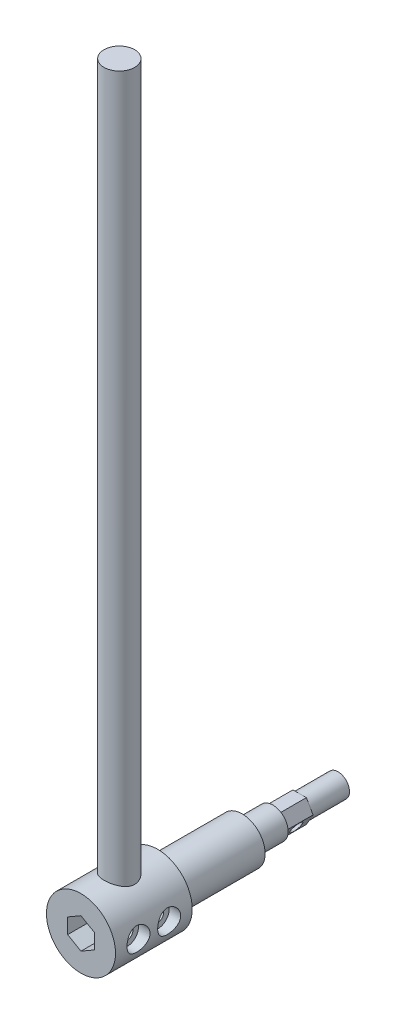
from build123d import *

# Parameters (mm, degrees)
SKETCH1_R                = 9
BOSS_EXTRUDE1_DEPTH      = 20
BOSS_EXTRUDE3_REACH      = 204.69
BOSS_EXTRUDE3_END_RADIUS = 9
SKETCH6_R                = 4
CUT_EXTRUDE1_DEPTH       = 9
CUT_EXTRUDE1_DEPTH_BACK  = 9
SKETCH8_R                = 1.55
SKETCH11_R               = 6
BOSS_EXTRUDE12_DEPTH     = 22
SKETCH12_R               = 4
BOSS_EXTRUDE13_DEPTH     = 8
BOSS_EXTRUDE14_DEPTH     = 7
SKETCH14_R               = 1.55
CUT_EXTRUDE2_DEPTH       = 6.1
SKETCH15_R               = 3
BOSS_EXTRUDE15_DEPTH     = 10
CUT_EXTRUDE5_START       = 9
SKETCH16_R               = 3
CUT_EXTRUDE5_DEPTH       = 3
CUT_EXTRUDE6_START       = -6
SKETCH16_2_R             = 3
CUT_EXTRUDE6_DEPTH       = 3


with BuildPart() as part:
    # Sketch1 → Boss-Extrude1 (new body)
    with BuildSketch(Plane.XY):
        Circle(SKETCH1_R)
        Polygon((0, 4), (3.464101615, 2), (3.464101615, -2), (0, -4), (-3.464101615, -2), (-3.464101615, 2), align=None, mode=Mode.SUBTRACT)
    extrude(amount=BOSS_EXTRUDE1_DEPTH)

    # Boss-Extrude3: up to this cylinder (the profile starts outside it)
    boss_extrude3_end = Plane(origin=(0, 0, 10), z_dir=(0, 0, -1)) * Cylinder(BOSS_EXTRUDE3_END_RADIUS, 428.38, mode=Mode.PRIVATE)
    # Sketch6 → Boss-Extrude3 (add, up to the surface)
    with BuildSketch(Plane(origin=(0, 192.5, 0), x_dir=(1, 0, 0), z_dir=(0, 1, 0)), mode=Mode.PRIVATE) as boss_extrude3_sk1:
        with Locations((0, -10)):
            Circle(SKETCH6_R)
    boss_extrude3_tool1 = extrude(boss_extrude3_sk1.sketch, amount=-BOSS_EXTRUDE3_REACH, mode=Mode.PRIVATE) - boss_extrude3_end
    add(boss_extrude3_tool1.solids().sort_by_distance((0, 192.5, 10))[0])

    # Sketch8 → Cut-Extrude1 (cut, two sides: drawn at the far end of the back side and taken through both)
    with BuildSketch(Plane.ZY.offset(-CUT_EXTRUDE1_DEPTH_BACK)):
        with Locations((6, 0)):
            Circle(SKETCH8_R)
        with Locations((14, 0)):
            Circle(SKETCH8_R)
    extrude(amount=CUT_EXTRUDE1_DEPTH + CUT_EXTRUDE1_DEPTH_BACK, mode=Mode.SUBTRACT)

    # Sketch11 → Boss-Extrude12 (add)
    with BuildSketch(Plane(origin=(0, 0, 0), x_dir=(-1, 0, 0), z_dir=(0, 0, -1))):
        Circle(SKETCH11_R)
    extrude(amount=BOSS_EXTRUDE12_DEPTH)

    # Sketch12 → Boss-Extrude13 (add)
    with BuildSketch(Plane(origin=(0, 0, -22), x_dir=(-1, 0, 0), z_dir=(0, 0, -1))):
        Circle(SKETCH12_R)
    extrude(amount=BOSS_EXTRUDE13_DEPTH)

    # Sketch13 → Boss-Extrude14 (add)
    with BuildSketch(Plane(origin=(0, 0, -30), x_dir=(-1, 0, 0), z_dir=(0, 0, -1))):
        Polygon((1.75, 3.031088913), (-1.75, 3.031088913), (-3.5, 0), (-1.75, -3.031088913), (1.75, -3.031088913), (3.5, 0), align=None)
    extrude(amount=BOSS_EXTRUDE14_DEPTH)

    # Sketch14 → Cut-Extrude2 (cut)
    with BuildSketch(Plane(origin=(2.625, -1.515544457, 0), x_dir=(0, 0, -1), z_dir=(0.8660254037844379, -0.5000000000000011, 0))):
        with Locations((33.5, 0)):
            Circle(SKETCH14_R)
    extrude(amount=-CUT_EXTRUDE2_DEPTH, mode=Mode.SUBTRACT)

    # Sketch15 → Boss-Extrude15 (add)
    with BuildSketch(Plane(origin=(0, 0, -37), x_dir=(-1, 0, 0), z_dir=(0, 0, -1))):
        Circle(SKETCH15_R)
    extrude(amount=BOSS_EXTRUDE15_DEPTH)

    # Sketch16 → Cut-Extrude5 (cut)
    with BuildSketch(Plane.ZY.offset(CUT_EXTRUDE5_START)):
        with Locations((6, 0)):
            Circle(SKETCH16_R)
        with Locations((14, 0)):
            Circle(SKETCH16_R)
    extrude(amount=-CUT_EXTRUDE5_DEPTH, mode=Mode.SUBTRACT)

    # Sketch16<2> → Cut-Extrude6 (cut)
    with BuildSketch(Plane.ZY.offset(CUT_EXTRUDE6_START)):
        with Locations((6, 0)):
            Circle(SKETCH16_2_R)
        with Locations((14, 0)):
            Circle(SKETCH16_2_R)
    extrude(amount=-CUT_EXTRUDE6_DEPTH, mode=Mode.SUBTRACT)


solid = part.part
